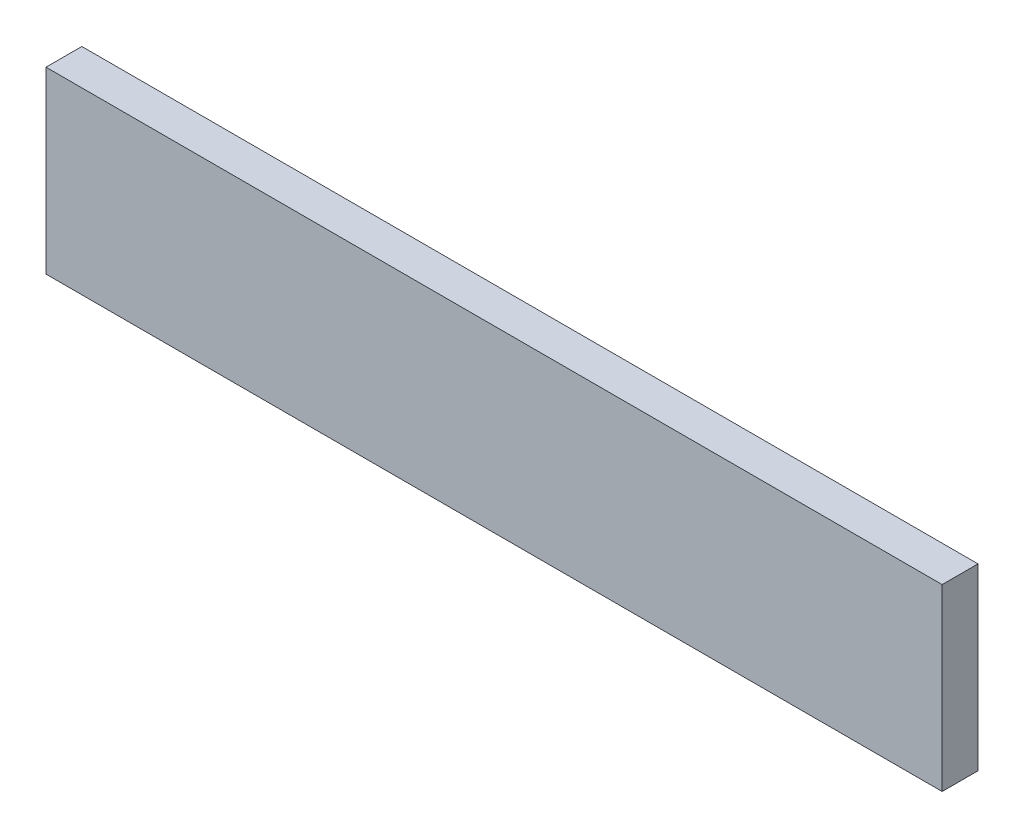
from build123d import *

# Parameters (mm, degrees)
SKETCH1_W           = 500
SKETCH1_H           = 100
BOSS_EXTRUDE1_DEPTH = 20


with BuildPart() as part:
    # Sketch1 → Boss-Extrude1 (new body)
    with BuildSketch(Plane.XY):
        with Locations((175.436412035, 11.294248609)):
            Rectangle(SKETCH1_W, SKETCH1_H)
    extrude(amount=BOSS_EXTRUDE1_DEPTH)


solid = part.part
